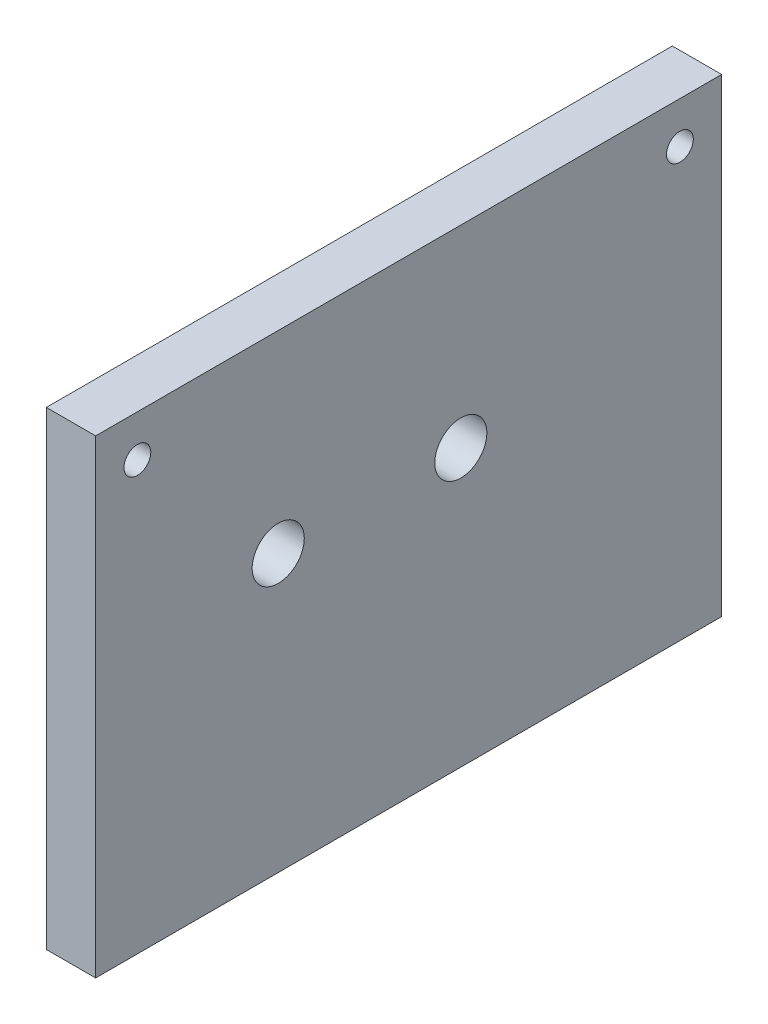
from build123d import *

# Parameters (mm, degrees)
SKETCH1_W                      = 152.4
SKETCH1_H                      = 114.3
SKETCH1_R                      = 6.34365
BOSS_EXTRUDE1_DEPTH            = 12
TAP_DRILL_FOR_10_32_TAP1_D     = 4.0386
TAP_DRILL_FOR_10_32_TAP1_DEPTH = 12.7
TAP_DRILL_FOR_10_32_TAP1_TIP   = 1.213317848
F_1_4_CLEARANCE_HOLE1_D        = 6.5278
F_1_4_CLEARANCE_HOLE1_DEPTH    = 12.7
F_1_4_CLEARANCE_HOLE1_TIP      = 1.961148974


with BuildPart() as part:
    # Sketch1 → Boss-Extrude1 (new body)
    with BuildSketch(Plane(origin=(0, 0, 0), x_dir=(0, 0, -1), z_dir=(1, 0, 0))):
        Rectangle(SKETCH1_W, SKETCH1_H)
        with Locations((-31.75, 10.16)):
            Circle(SKETCH1_R, mode=Mode.SUBTRACT)
        with Locations((12.7, 10.16)):
            Circle(SKETCH1_R, mode=Mode.SUBTRACT)
    extrude(amount=BOSS_EXTRUDE1_DEPTH)

    # Tap Drill for #10-32 Tap1
    with Locations(Plane(origin=(0, -57.15, 0), x_dir=(-1, 0, 0), z_dir=(0, -1, 0))):
        with Locations((-6, -66.675), (-6, 0), (-6, 66.675)):
            Hole(TAP_DRILL_FOR_10_32_TAP1_D / 2, depth=TAP_DRILL_FOR_10_32_TAP1_DEPTH)
            with Locations((0, 0, -(TAP_DRILL_FOR_10_32_TAP1_DEPTH + TAP_DRILL_FOR_10_32_TAP1_TIP / 2))):  # 118° drill point
                Cone(0, TAP_DRILL_FOR_10_32_TAP1_D / 2, TAP_DRILL_FOR_10_32_TAP1_TIP, mode=Mode.SUBTRACT)

    # 1/4 Clearance Hole1
    with Locations(Plane.ZY):
        with Locations((-66.04, 46.99), (66.04, 46.99)):
            Hole(F_1_4_CLEARANCE_HOLE1_D / 2, depth=F_1_4_CLEARANCE_HOLE1_DEPTH)
            with Locations((0, 0, -(F_1_4_CLEARANCE_HOLE1_DEPTH + F_1_4_CLEARANCE_HOLE1_TIP / 2))):  # 118° drill point
                Cone(0, F_1_4_CLEARANCE_HOLE1_D / 2, F_1_4_CLEARANCE_HOLE1_TIP, mode=Mode.SUBTRACT)


solid = part.part
